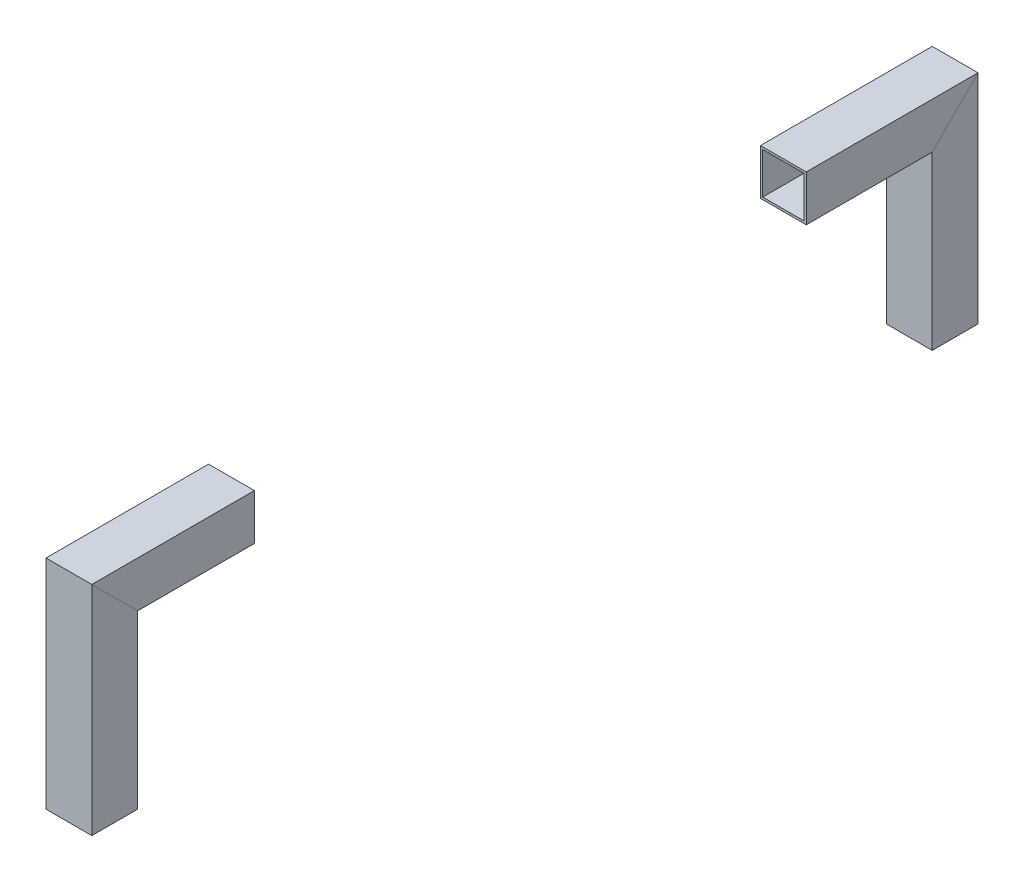
from build123d import *

# Parameters (mm, degrees)
SKETCH_11_W                = 20
SKETCH_11_H                = 20
SKETCH_11_W_2              = 18
SKETCH_11_H_2              = 18
F_20X20X1_1_DEPTH          = 100.142135624
SKETCH_11_ON_SEGMENT_2_W   = 20
SKETCH_11_ON_SEGMENT_2_H   = 20
SKETCH_11_ON_SEGMENT_2_W_2 = 18
SKETCH_11_ON_SEGMENT_2_H_2 = 18
F_20X20X1_1_2_DEPTH        = 397.284271247
SKETCH_11_ON_SEGMENT_3_W   = 20
SKETCH_11_ON_SEGMENT_3_H   = 20
SKETCH_11_ON_SEGMENT_3_W_2 = 18
SKETCH_11_ON_SEGMENT_3_H_2 = 18
F_20X20X1_1_3_DEPTH        = 100.142135624
CUT_EXTRUDE_1_REACH        = 391.299
SKETCH_12_R                = 1.5
SKETCH_14_W                = 241
SKETCH_14_H                = 20
CUT_EXTRUDE_3_DEPTH        = 390.299370665


with BuildPart() as part:
    # 草图11 → 铝管 20X20X1(1) (new body)
    with BuildSketch(Plane.ZX):
        Rectangle(SKETCH_11_W, SKETCH_11_H)
        Rectangle(SKETCH_11_W_2, SKETCH_11_H_2, mode=Mode.SUBTRACT)
    extrude(amount=F_20X20X1_1_DEPTH)

    # 铝管 20X20X1(1) mitre 1
    split(bisect_by=Plane(origin=(0, 85, 0), x_dir=(1, 0, 0), z_dir=(0, -0.707106781, 0.707106781)), keep=Keep.TOP)


with BuildPart() as body_2:
    # 草图11 on segment 2 (carried to segment 2) → 20X20X1_1 2 (new body)
    with BuildSketch(Plane(origin=(0, 85, 15.142135624), x_dir=(0, 1, 0), z_dir=(0, 0, -1))):
        Rectangle(SKETCH_11_ON_SEGMENT_2_W, SKETCH_11_ON_SEGMENT_2_H)
        Rectangle(SKETCH_11_ON_SEGMENT_2_W_2, SKETCH_11_ON_SEGMENT_2_H_2, mode=Mode.SUBTRACT)
    extrude(amount=F_20X20X1_1_2_DEPTH)

    # 20X20X1_1 2 mitre 1
    split(bisect_by=Plane(origin=(0, 85, 0), x_dir=(-1, 0, 0), z_dir=(0, 0.707106781, -0.707106781)), keep=Keep.TOP)

    # 20X20X1_1 2 mitre 2
    split(bisect_by=Plane(origin=(0, 85, -367), x_dir=(-1, 0, 0), z_dir=(0, 0.707106781, 0.707106781)), keep=Keep.TOP)

    # 切除-拉伸1: up to this face of the body (flat: up to its plane)
    cut_extrude_1_end = Plane(body_2.part.faces().sort_by_distance((-10, 85.181653043, -183.5))[0])
    # 草图12 → 切除-拉伸1 (cut, up to the picked face)
    with BuildSketch(Plane(origin=(10, 0, 0), x_dir=(0, 0, -1), z_dir=(1, 0, 0)), mode=Mode.PRIVATE) as cut_extrude_1_sk1:
        with Locations((133.5, 81)):
            Circle(SKETCH_12_R)
    cut_extrude_1_tool1 = split(extrude(cut_extrude_1_sk1.sketch, amount=-CUT_EXTRUDE_1_REACH, mode=Mode.PRIVATE), bisect_by=cut_extrude_1_end, keep=Keep.BOTH, mode=Mode.PRIVATE)
    # 草图12 → 切除-拉伸1 (cut, up to the picked face)
    with BuildSketch(Plane(origin=(10, 0, 0), x_dir=(0, 0, -1), z_dir=(1, 0, 0)), mode=Mode.PRIVATE) as cut_extrude_1_sk2:
        with Locations((233.5, 81)):
            Circle(SKETCH_12_R)
    cut_extrude_1_tool2 = split(extrude(cut_extrude_1_sk2.sketch, amount=-CUT_EXTRUDE_1_REACH, mode=Mode.PRIVATE), bisect_by=cut_extrude_1_end, keep=Keep.BOTH, mode=Mode.PRIVATE)
    add(cut_extrude_1_tool1.solids().sort_by(Axis((10, 81, -133.5), (-1, 0, 0)))[0], mode=Mode.SUBTRACT)
    add(cut_extrude_1_tool2.solids().sort_by(Axis((10, 81, -233.5), (-1, 0, 0)))[0], mode=Mode.SUBTRACT)

    # 草图14 → 切除-拉伸3 (cut, through all)
    with BuildSketch(Plane(origin=(10, 0, 0), x_dir=(0, 0, -1), z_dir=(1, 0, 0))):
        with Locations((181.5, 85)):
            Rectangle(SKETCH_14_W, SKETCH_14_H)
    extrude(amount=-CUT_EXTRUDE_3_DEPTH, mode=Mode.SUBTRACT)


with BuildPart() as body_3:
    # 草图11 on segment 3 (carried to segment 3) → 20X20X1_1 3 (new body)
    with BuildSketch(Plane(origin=(0, 100.142135624, -367), x_dir=(0, 0, -1), z_dir=(0, -1, 0))):
        Rectangle(SKETCH_11_ON_SEGMENT_3_W, SKETCH_11_ON_SEGMENT_3_H)
        Rectangle(SKETCH_11_ON_SEGMENT_3_W_2, SKETCH_11_ON_SEGMENT_3_H_2, mode=Mode.SUBTRACT)
    extrude(amount=F_20X20X1_1_3_DEPTH)

    # 20X20X1_1 3 mitre 1
    split(bisect_by=Plane(origin=(0, 85, -367), x_dir=(1, 0, 0), z_dir=(0, -0.707106781, -0.707106781)), keep=Keep.TOP)


with BuildPart() as cut_extrude_3_piece_1:
    # of the separate pieces the step leaves, piece 1, a body of its own (cut_extrude_3_pieces)
    add(body_2.part.solids().sort_by_distance((-10, 75, -302))[0])


with BuildPart() as cut_extrude_3_piece_2:
    # of the separate pieces the step leaves, piece 2, a body of its own (cut_extrude_3_pieces)
    add(body_2.part.solids().sort_by_distance((-10, 75, -10))[0])


solid = Compound([part.part, body_3.part, cut_extrude_3_piece_1.part, cut_extrude_3_piece_2.part])
